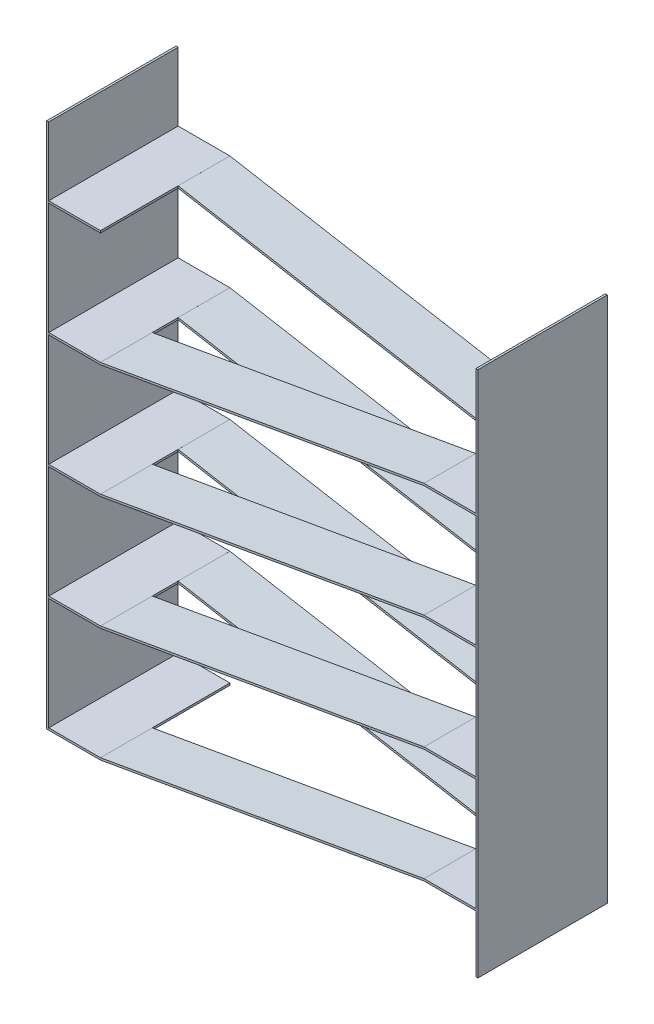
from build123d import *

# Parameters (mm, degrees)
SKETCH4_W             = 120
SKETCH4_H             = 4.76
BOSS_EXTRUDE6_DEPTH   = 300
BOSS_EXTRUDE6_2_DEPTH = 300
BOSS_EXTRUDE6_3_DEPTH = 300
BOSS_EXTRUDE6_4_DEPTH = 300
BOSS_EXTRUDE6_5_DEPTH = 300
BOSS_EXTRUDE6_6_DEPTH = 300
BOSS_EXTRUDE6_7_DEPTH = 300
BOSS_EXTRUDE6_8_DEPTH = 300
BOSS_EXTRUDE6_9_DEPTH = 300
BOSS_EXTRUDE7_DEPTH   = 120
BOSS_EXTRUDE8_START   = -180
BOSS_EXTRUDE8_DEPTH   = 120
BOSS_EXTRUDE10_START  = -50
SKETCH5_W             = 300
SKETCH5_H             = 1221.083607577
BOSS_EXTRUDE10_DEPTH  = 4.76
BOSS_EXTRUDE11_START  = 940
SKETCH5_3_W           = 300
SKETCH5_3_H           = 1221.083607577
BOSS_EXTRUDE11_DEPTH  = 4.76


with BuildPart() as part:
    # Sketch4 → Boss-Extrude6 (new body)
    with BuildSketch(Plane.XY):
        with Locations((9.905526623, -18.703607577)):
            Rectangle(SKETCH4_W, SKETCH4_H)
    extrude(amount=-BOSS_EXTRUDE6_DEPTH)



with BuildPart() as body_2:
    # Sketch4 → Boss-Extrude6 2 (new body)
    with BuildSketch(Plane.XY):
        with Locations((879.905526623, 113.541627954)):
            Rectangle(SKETCH4_W, SKETCH4_H)
    extrude(amount=-BOSS_EXTRUDE6_2_DEPTH)


with BuildPart() as body_3:
    # Sketch4 → Boss-Extrude6 3 (new body)
    with BuildSketch(Plane.XY):
        with Locations((9.905526623, 245.796392423)):
            Rectangle(SKETCH4_W, SKETCH4_H)
    extrude(amount=-BOSS_EXTRUDE6_3_DEPTH)


with BuildPart() as body_4:
    # Sketch4 → Boss-Extrude6 4 (new body)
    with BuildSketch(Plane.XY):
        with Locations((879.905526623, 378.041627954)):
            Rectangle(SKETCH4_W, SKETCH4_H)
    extrude(amount=-BOSS_EXTRUDE6_4_DEPTH)


with BuildPart() as body_5:
    # Sketch4 → Boss-Extrude6 5 (new body)
    with BuildSketch(Plane.XY):
        with Locations((9.905526623, 510.296392423)):
            Rectangle(SKETCH4_W, SKETCH4_H)
    extrude(amount=-BOSS_EXTRUDE6_5_DEPTH)


with BuildPart() as body_6:
    # Sketch4 → Boss-Extrude6 6 (new body)
    with BuildSketch(Plane.XY):
        with Locations((879.905526623, 642.541627954)):
            Rectangle(SKETCH4_W, SKETCH4_H)
    extrude(amount=-BOSS_EXTRUDE6_6_DEPTH)


with BuildPart() as body_7:
    # Sketch4 → Boss-Extrude6 7 (new body)
    with BuildSketch(Plane.XY):
        with Locations((9.905526623, 774.796392423)):
            Rectangle(SKETCH4_W, SKETCH4_H)
    extrude(amount=-BOSS_EXTRUDE6_7_DEPTH)


with BuildPart() as body_8:
    # Sketch4 → Boss-Extrude6 8 (new body)
    with BuildSketch(Plane.XY):
        with Locations((879.905526623, 907.041627954)):
            Rectangle(SKETCH4_W, SKETCH4_H)
    extrude(amount=-BOSS_EXTRUDE6_8_DEPTH)


with BuildPart() as body_9:
    # Sketch4 → Boss-Extrude6 9 (new body)
    with BuildSketch(Plane.XY):
        with Locations((9.905526623, 1039.296392423)):
            Rectangle(SKETCH4_W, SKETCH4_H)
    extrude(amount=-BOSS_EXTRUDE6_9_DEPTH)


with BuildPart() as part_1:
    add(part.part)

    add(body_3.part)  # Boss-Extrude7 merges body 3

    add(body_5.part)  # Boss-Extrude7 merges body 5

    add(body_7.part)  # Boss-Extrude7 merges body 7
    # Sketch4<3> → Boss-Extrude7 (add)
    with BuildSketch(Plane.XY):
        Polygon((69.905526623, -16.323607577), (69.905526623, -21.083607577), (819.905526623, 111.161627954), (819.905526623, 115.921627954), align=None)
        Polygon((69.905526623, 248.176392423), (69.905526623, 243.416392423), (819.905526623, 375.661627954), (819.905526623, 380.421627954), align=None)
        Polygon((69.905526623, 507.916392423), (819.905526623, 640.161627954), (819.905526623, 644.921627954), (69.905526623, 512.676392423), align=None)
        Polygon((69.905526623, 772.416392423), (819.905526623, 904.661627954), (819.905526623, 909.421627954), (69.905526623, 777.176392423), align=None)
    extrude(amount=-BOSS_EXTRUDE7_DEPTH)


    add(body_2.part)  # Boss-Extrude8 merges body 2

    add(body_4.part)  # Boss-Extrude8 merges body 4

    add(body_6.part)  # Boss-Extrude8 merges body 6

    add(body_8.part)  # Boss-Extrude8 merges body 8

    add(body_9.part)  # Boss-Extrude8 merges body 9
    # Sketch4<4> → Boss-Extrude8 (add)
    with BuildSketch(Plane.XY.offset(BOSS_EXTRUDE8_START)):
        Polygon((819.905526623, 111.161627954), (819.905526623, 115.921627954), (69.905526623, 248.166863486), (69.905526623, 243.406863486), align=None)
        Polygon((819.905526623, 375.661627954), (819.905526623, 380.421627954), (69.905526623, 512.666863486), (69.905526623, 507.906863486), align=None)
        Polygon((819.905526623, 640.161627954), (819.905526623, 644.921627954), (69.905526623, 777.166863486), (69.905526623, 772.406863486), align=None)
        Polygon((819.905526623, 904.661627954), (819.905526623, 909.421627954), (69.905526623, 1041.666863486), (69.905526623, 1036.906863486), align=None)
    extrude(amount=-BOSS_EXTRUDE8_DEPTH)


with BuildPart() as body_2_2:
    # Sketch5 → Boss-Extrude10 (new body)
    with BuildSketch(Plane(origin=(0, 0, 0), x_dir=(0, 0, -1), z_dir=(1, 0, 0)).offset(BOSS_EXTRUDE10_START)):
        with Locations((150, 589.458196211)):
            Rectangle(SKETCH5_W, SKETCH5_H)
    extrude(amount=-BOSS_EXTRUDE10_DEPTH)


with BuildPart() as body_3_2:
    # Sketch5<3> → Boss-Extrude11 (new body)
    with BuildSketch(Plane(origin=(0, 0, 0), x_dir=(0, 0, -1), z_dir=(1, 0, 0)).offset(BOSS_EXTRUDE11_START)):
        with Locations((150, 589.458196211)):
            Rectangle(SKETCH5_3_W, SKETCH5_3_H)
    extrude(amount=BOSS_EXTRUDE11_DEPTH)


solid = Compound([part_1.part, body_2_2.part, body_3_2.part])
